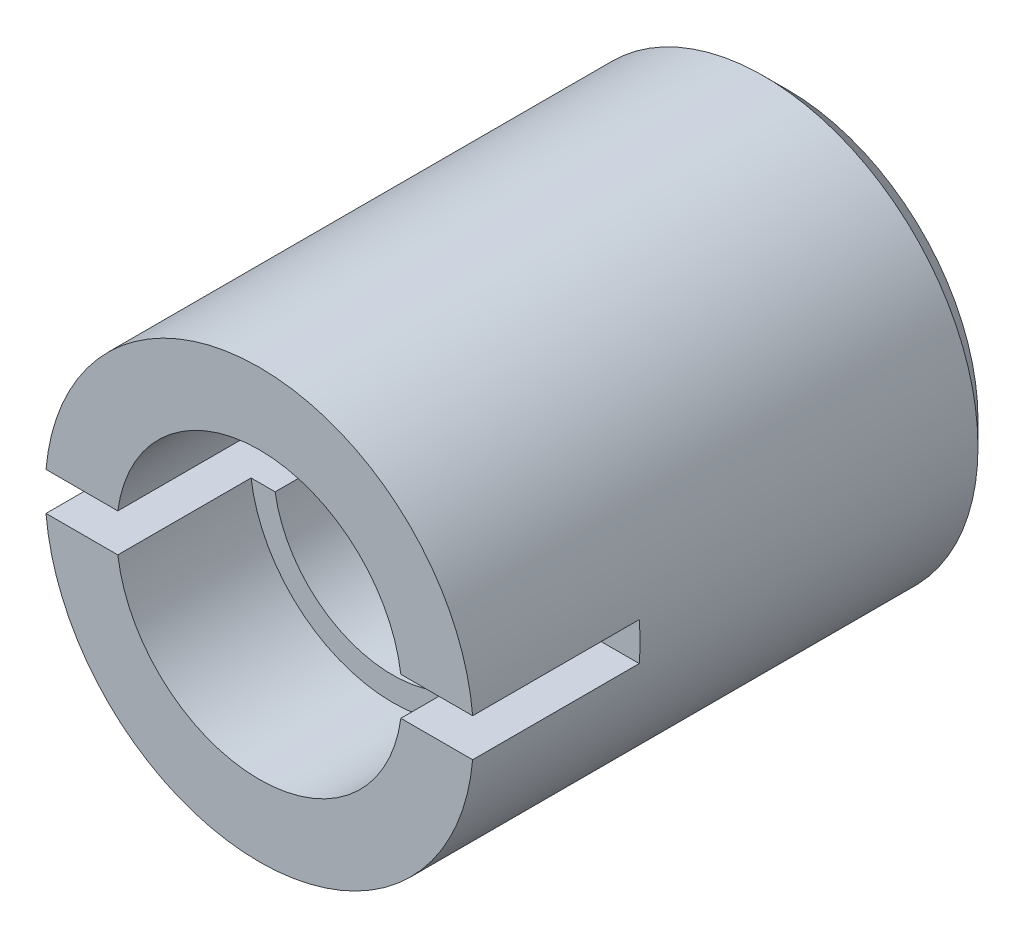
from build123d import *

# Parameters (mm, degrees)
SKETCH1_R           = 2.75
SKETCH1_R_2         = 1.4
BOSS_EXTRUDE1_DEPTH = 0.5
SKETCH2_R           = 4.5
SKETCH2_R_2         = 1.4
BOSS_EXTRUDE2_DEPTH = 6.1
CHAMFER1_SIZE       = 0.5
SKETCH3_R           = 4.5
SKETCH3_R_2         = 2.5
BOSS_EXTRUDE3_DEPTH = 2.2
SKETCH4_R           = 4.5
SKETCH4_R_2         = 3
BOSS_EXTRUDE4_DEPTH = 2.8
SKETCH5_W           = 0.8
SKETCH5_H           = 3.5
CUT_EXTRUDE1_DEPTH  = 4.5


with BuildPart() as part:
    # Sketch1 → Boss-Extrude1 (new body)
    with BuildSketch(Plane(origin=(0, 0, 0), x_dir=(0, 1, 0), z_dir=(0, 0, 1))):
        with Locations(Location((0, 0, 0), (0, 0, 270))):
            Circle(SKETCH1_R)
        with Locations(Location((0, 0, 0), (0, 0, 270))):
            Circle(SKETCH1_R_2, mode=Mode.SUBTRACT)
    extrude(amount=BOSS_EXTRUDE1_DEPTH)

    # Sketch2 → Boss-Extrude2 (add)
    with BuildSketch(Plane.XY.offset(0.5)):
        Circle(SKETCH2_R)
        Circle(SKETCH2_R_2, mode=Mode.SUBTRACT)
    extrude(amount=BOSS_EXTRUDE2_DEPTH)

    # Chamfer1
    chamfer1_edges = [part.edges().sort_by_distance(p)[0] for p in [
        (-4.5, 0, 0.5),
    ]]
    chamfer(chamfer1_edges, length=CHAMFER1_SIZE)

    # Sketch3 → Boss-Extrude3 (add)
    with BuildSketch(Plane.XY.offset(6.6)):
        Circle(SKETCH3_R)
        Circle(SKETCH3_R_2, mode=Mode.SUBTRACT)
    extrude(amount=BOSS_EXTRUDE3_DEPTH)

    # Sketch4 → Boss-Extrude4 (add)
    with BuildSketch(Plane.XY.offset(8.8)):
        Circle(SKETCH4_R)
        Circle(SKETCH4_R_2, mode=Mode.SUBTRACT)
    extrude(amount=BOSS_EXTRUDE4_DEPTH)

    # Sketch5 → Cut-Extrude1 (cut, symmetric)
    with BuildSketch(Plane.YZ):
        with Locations((0, 9.85)):
            Rectangle(SKETCH5_W, SKETCH5_H)
    extrude(amount=CUT_EXTRUDE1_DEPTH, both=True, mode=Mode.SUBTRACT)


solid = part.part
